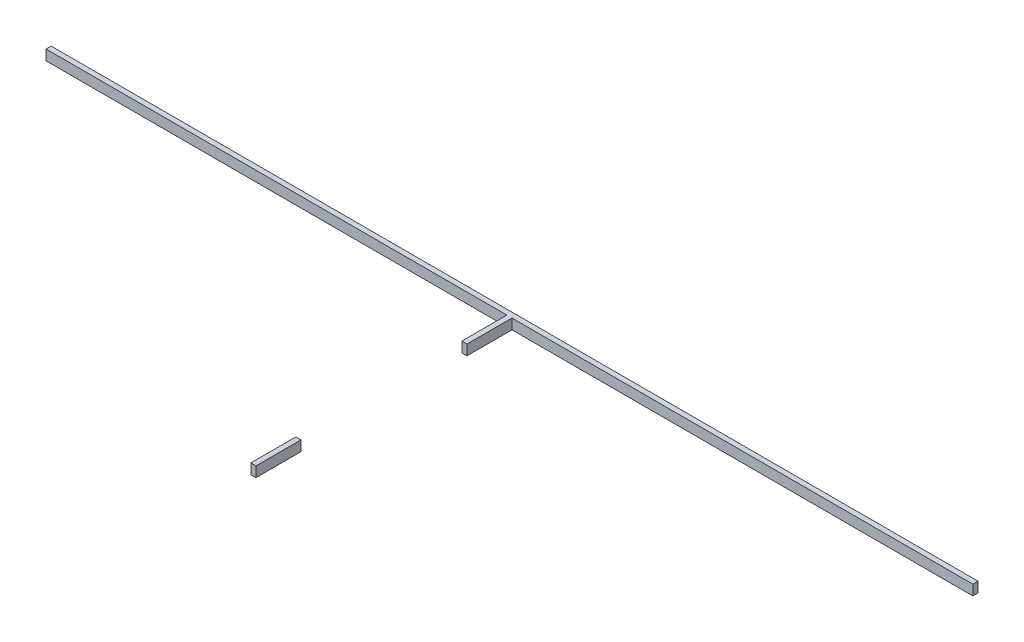
from build123d import *

# Parameters (mm, degrees)
EXTRUDE_1_DEPTH   = 100
SKETCH_1_W        = 50
SKETCH_1_H        = 440
EXTRUDE_1_2_DEPTH = 100


with BuildPart() as part:
    # 草图1 → 凸台-拉伸1 (new body)
    with BuildSketch(Plane(origin=(0, 0, 0), x_dir=(1, 0, 0), z_dir=(0, 1, 0))):
        Polygon((-4525, 0), (4525, 0), (4525, -50), (25, -50), (25, -490), (-25, -490), (-25, -50), (-4525, -50), align=None)
    extrude(amount=EXTRUDE_1_DEPTH)


with BuildPart() as body_2:
    # 草图1 → Extrude 1 2 (new body)
    with BuildSketch(Plane(origin=(0, 0, 0), x_dir=(1, 0, 0), z_dir=(0, 1, 0))):
        with Locations((0, -2330)):
            Rectangle(SKETCH_1_W, SKETCH_1_H)
    extrude(amount=EXTRUDE_1_2_DEPTH)


solid = Compound([part.part, body_2.part])
